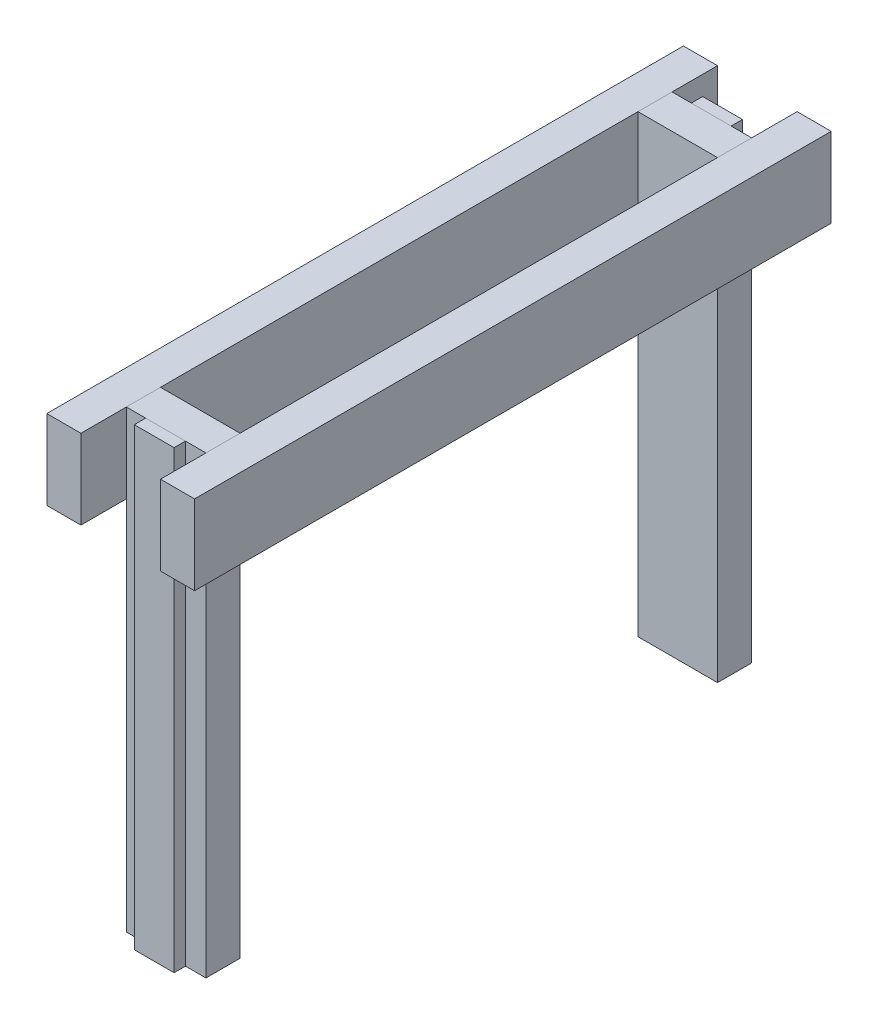
from build123d import *

# Parameters (mm, degrees)
SKETCH3_W            = 88.9
SKETCH3_H            = 38.1
VERTICAL_BOARD_DEPTH = 508
SKETCH6_W            = 711.2
SKETCH6_H            = 88.9
LATERAL_BOARD_DEPTH  = 38.1
SKETCH7_W            = 44.45
SKETCH7_H            = 508
DRAWER_SLIDE_DEPTH   = 12.7


with BuildPart() as part:
    # Sketch3 → Vertical Board (new body)
    with BuildSketch(Plane(origin=(0, 0, 0), x_dir=(1, 0, 0), z_dir=(0, 1, 0))):
        with Locations((0, -285.75)):
            Rectangle(SKETCH3_W, SKETCH3_H)
    extrude(amount=-VERTICAL_BOARD_DEPTH)


with BuildPart() as body_2:
    # Vertical Board Mirror: mirrored copy
    add(part.part.mirror(Plane.XY))


with BuildPart() as body_3:
    # Sketch6 → Lateral Board (new body)
    with BuildSketch(Plane(origin=(44.45, 0, 0), x_dir=(0, 0, -1), z_dir=(1, 0, 0))):
        with Locations((0, -44.45)):
            Rectangle(SKETCH6_W, SKETCH6_H)
    extrude(amount=LATERAL_BOARD_DEPTH)


with BuildPart() as body_4:
    # Lateral Board Mirror: mirrored copy
    add(body_3.part.mirror(Plane(origin=(0, 0, 0), x_dir=(0, 0, 1), z_dir=(1, 0, 0))))


with BuildPart() as body_5:
    # Sketch7 → Drawer Slide (new body)
    with BuildSketch(Plane.XY.offset(304.8)):
        with Locations((-0.675755403, -254)):
            Rectangle(SKETCH7_W, SKETCH7_H)
    extrude(amount=DRAWER_SLIDE_DEPTH)


with BuildPart() as body_6:
    # Drawer Slide Mirror: mirrored copy
    add(body_5.part.mirror(Plane.XY))


solid = Compound([part.part, body_2.part, body_3.part, body_4.part, body_5.part, body_6.part])
